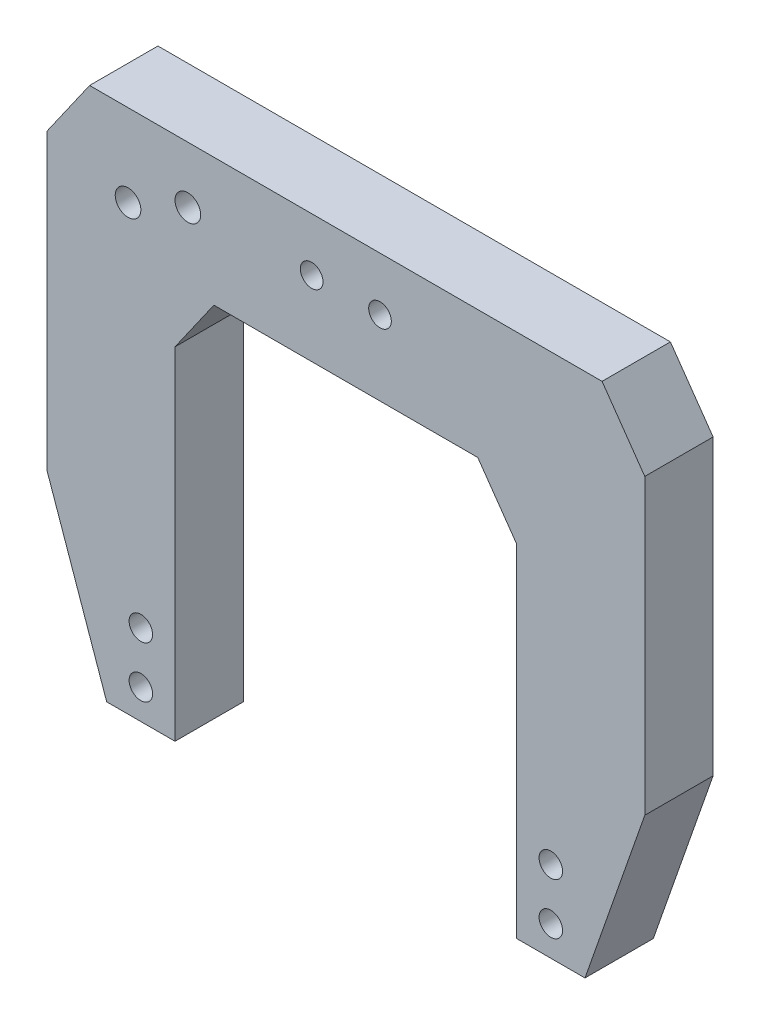
from build123d import *

# Parameters (mm, degrees)
DODANIE_WYCI_GNI_CIE1_DEPTH                       = 8
POG_BIENIE_WALCOWE_POD_M5_RUB_Z_BEM_W_D           = 5.3
POG_BIENIE_WALCOWE_POD_M5_RUB_Z_BEM_W_DEPTH       = 60
POG_BIENIE_WALCOWE_POD_M5_RUB_Z_BEM_W_CBORE_D     = 10
POG_BIENIE_WALCOWE_POD_M5_RUB_Z_BEM_W_CBORE_DEPTH = 2
POG_BIENIE_WALCOWE_POD_M5_RUB_Z_BEM_W_TIP         = 1.59228064
POG_BIENIE_WALCOWE_POD_M5_RUB_Z_B_2_A_COUNT       = 2
POG_BIENIE_WALCOWE_POD_M5_RUB_Z_B_2_A_PITCH       = 12
OTWORY_USTALAJ_CE_6_0MM1_D                        = 6
OTWORY_USTALAJ_CE_6_0MM1_DEPTH                    = 32
OTWORY_USTALAJ_CE_6_0MM1_TIP                      = 1.802581857


with BuildPart() as part:
    # Szkic1 → Dodanie-wyciągnięcie1 (new, symmetric)
    with BuildSketch(Plane.XY):
        Polygon((0, 93), (0, 123), (60, 123), (70, 108.718519933), (70, 40), (56, 0), (40, 0), (40, 80), (30.897302003, 93), align=None)
    dodanie_wyci_gni_cie1 = extrude(amount=DODANIE_WYCI_GNI_CIE1_DEPTH, both=True)

    # Lustro1: Dodanie-wyciągnięcie1 across plane
    add(dodanie_wyci_gni_cie1.mirror(Plane(origin=(0, 93, 8), x_dir=(0, 0, 1), z_dir=(1, 0, 0))))

    # Pog_bienie walcowe pod M5 _rub_ z _bem w
    with Locations(Plane(origin=(156.349537134, 156, 18.427358502), x_dir=(1, 0, 0), z_dir=(0, 0, 1))):
        with Locations((-164.349537134, -45.5), (-148.349537134, -45.5)):
            CounterBoreHole(POG_BIENIE_WALCOWE_POD_M5_RUB_Z_BEM_W_D / 2, POG_BIENIE_WALCOWE_POD_M5_RUB_Z_BEM_W_CBORE_D / 2, POG_BIENIE_WALCOWE_POD_M5_RUB_Z_BEM_W_CBORE_DEPTH, depth=POG_BIENIE_WALCOWE_POD_M5_RUB_Z_BEM_W_DEPTH)
            with Locations((0, 0, -(POG_BIENIE_WALCOWE_POD_M5_RUB_Z_BEM_W_DEPTH + POG_BIENIE_WALCOWE_POD_M5_RUB_Z_BEM_W_TIP / 2))):  # 118° drill point
                Cone(0, POG_BIENIE_WALCOWE_POD_M5_RUB_Z_BEM_W_D / 2, POG_BIENIE_WALCOWE_POD_M5_RUB_Z_BEM_W_TIP, mode=Mode.SUBTRACT)

    # Szkic9 → Pog_bienie walcowe pod M5 _rub_ z _b 2 (revolve, cut)
    with BuildSketch(Plane(origin=(-48, 7, -22), x_dir=(0, 1, 0), z_dir=(1, 0, 0))):
        Polygon((0, 0), (0, 45.652366702), (2.75, 44), (2.75, 5), (5, 5), (5, 0), align=None)
    pog_bienie_walcowe_pod_m5_rub_z_b_2 = revolve(axis=Axis((-48, 7, -28.35), (0, 0, 1)), mode=Mode.SUBTRACT)

    # Pog_bienie walcowe pod M5 _rub_ z _b 2 a: Pog_bienie walcowe pod M5 _rub_ z _b 2 ×2
    with Locations(*[(0, i * POG_BIENIE_WALCOWE_POD_M5_RUB_Z_B_2_A_PITCH, 0) for i in range(1, POG_BIENIE_WALCOWE_POD_M5_RUB_Z_B_2_A_COUNT)]):
        add(pog_bienie_walcowe_pod_m5_rub_z_b_2, mode=Mode.SUBTRACT)

    # Lustro2: Pog_bienie walcowe pod M5 _rub_ z _b 2 across plane
    add(pog_bienie_walcowe_pod_m5_rub_z_b_2.mirror(Plane(origin=(0, 0, 0), x_dir=(0, 0, 1), z_dir=(1, 0, 0))), mode=Mode.SUBTRACT)

    # Lustro2 copy 1 sketch → Lustro2 copy 1 (revolve, cut)
    with BuildSketch(Plane(origin=(48, 19, -22), x_dir=(0, 1, 0), z_dir=(-1, 0, 0))):
        Polygon((0, 0), (0, -45.652366702), (2.75, -44), (2.75, -5), (5, -5), (5, 0), align=None)
    revolve(axis=Axis((48, 19, -28.35), (0, 0, -1)), mode=Mode.SUBTRACT)

    # Otwory ustalające Ø6.0mm1
    with Locations(Plane(origin=(156.349537134, 156, 8), x_dir=(1, 0, 0), z_dir=(0, 0, 1))):
        with Locations((-193.349537133, -46.25), (-207.349537133, -52.25)):
            Hole(OTWORY_USTALAJ_CE_6_0MM1_D / 2, depth=OTWORY_USTALAJ_CE_6_0MM1_DEPTH)
            with Locations((0, 0, -(OTWORY_USTALAJ_CE_6_0MM1_DEPTH + OTWORY_USTALAJ_CE_6_0MM1_TIP / 2))):  # 118° drill point
                Cone(0, OTWORY_USTALAJ_CE_6_0MM1_D / 2, OTWORY_USTALAJ_CE_6_0MM1_TIP, mode=Mode.SUBTRACT)


solid = part.part
